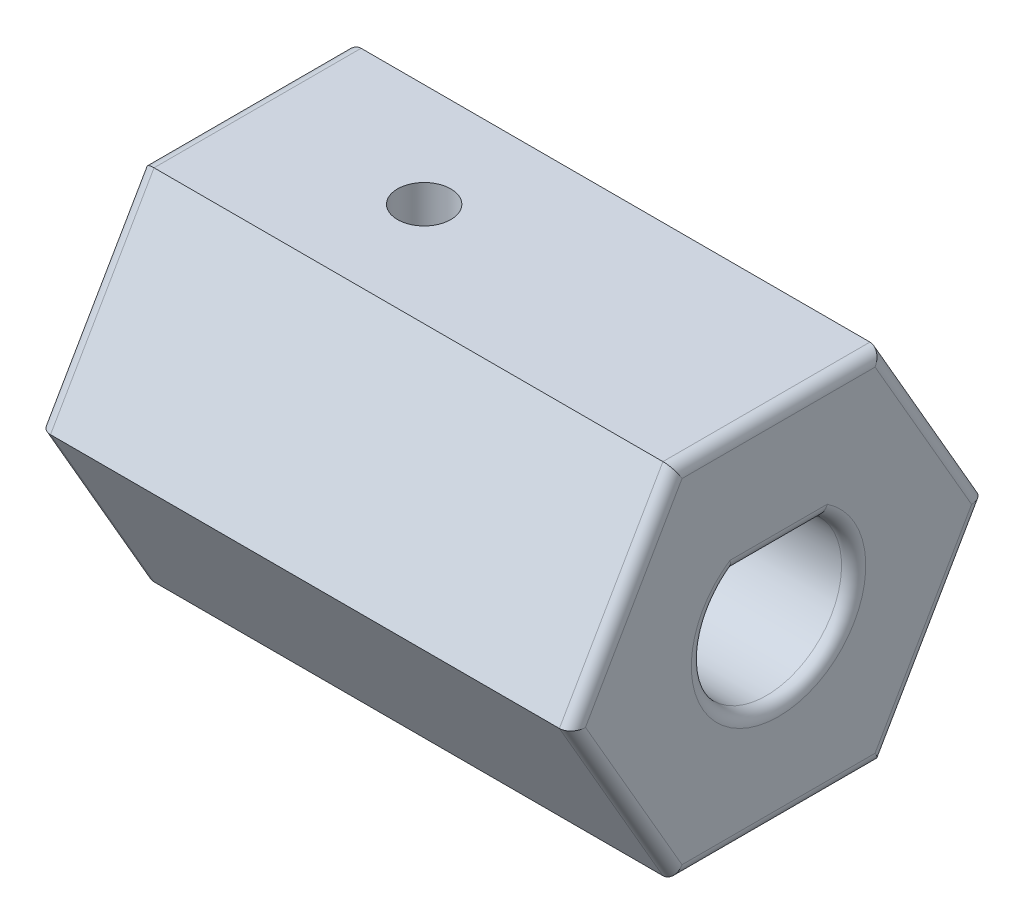
from build123d import *

# Parameters (mm, degrees)
SALIENTE_EXTRUIR1_DEPTH      = 12
SALIENTE_EXTRUIR2_DEPTH      = 10
SALIENTE_EXTRUIR2_DEPTH_BACK = 12
CROQUIS3_R                   = 1.1
CORTAR_EXTRUIR1_DEPTH        = 4.912531407
REDONDEO1_R                  = 0.5


with BuildPart() as part:
    # Croquis1 → Saliente-Extruir1 (new body)
    with BuildSketch(Plane(origin=(0, 0, 0), x_dir=(0, 0, -1), z_dir=(1, 0, 0))):
        with BuildLine():
            Line((-2.1, 3.987468593), (2.1, 3.987468593))
            ThreePointArc((2.1, 3.987468593), (0, -4.506651282), (-2.1, 3.987468593))
        make_face()
        with BuildLine():
            Line((-1.85, 2.487468593), (1.85, 2.487468593))
            ThreePointArc((1.85, 2.487468593), (0, -3.1), (-1.85, 2.487468593))
        make_face(mode=Mode.SUBTRACT)
    extrude(amount=SALIENTE_EXTRUIR1_DEPTH)

    # Croquis2 → Saliente-Extruir2 (add, two sides: drawn at the far end of the back side and taken through both)
    with BuildSketch(Plane(origin=(12, 0, 0), x_dir=(0, 0, -1), z_dir=(1, 0, 0)).offset(-SALIENTE_EXTRUIR2_DEPTH_BACK)):
        Polygon((-4.272391992, -7.4), (4.272391992, -7.4), (8.544783984, 0), (4.272391992, 7.4), (-4.272391992, 7.4), (-8.544783984, 0), align=None)
        with BuildLine():
            Line((-1.85, 2.487468593), (1.85, 2.487468593))
            ThreePointArc((1.85, 2.487468593), (0, -3.1), (-1.85, 2.487468593))
        make_face(mode=Mode.SUBTRACT)
    extrude(amount=SALIENTE_EXTRUIR2_DEPTH + SALIENTE_EXTRUIR2_DEPTH_BACK)

    # Croquis3 → Cortar-Extruir1 (cut)
    with BuildSketch(Plane.XZ.offset(-2.487468593)):
        with Locations(Location((7.375, 0, 0), (0, 0, 270))):
            Circle(CROQUIS3_R)
    extrude(amount=-CORTAR_EXTRUIR1_DEPTH, mode=Mode.SUBTRACT)

    # Redondeo1
    redondeo1_edges = [part.edges().sort_by_distance(p)[0] for p in [
        (0, 2.487468593, 0),
        (22, -3.7, 6.408587988),
        (22, -7.4, 0),
        (22, -3.7, -6.408587988),
        (22, 3.7, -6.408587988),
        (22, 7.4, 0),
        (22, 3.7, 6.408587988),
        (0, -3.7, 6.408587988),
        (0, -7.4, 0),
        (0, -3.7, -6.408587988),
        (0, 3.7, -6.408587988),
        (0, 7.4, 0),
        (0, 3.7, 6.408587988),
        (22, -3.1, 0),
        (22, 2.487468593, 0),
        (0, -3.1, 0),
    ]]
    fillet(redondeo1_edges, radius=REDONDEO1_R)


solid = part.part
